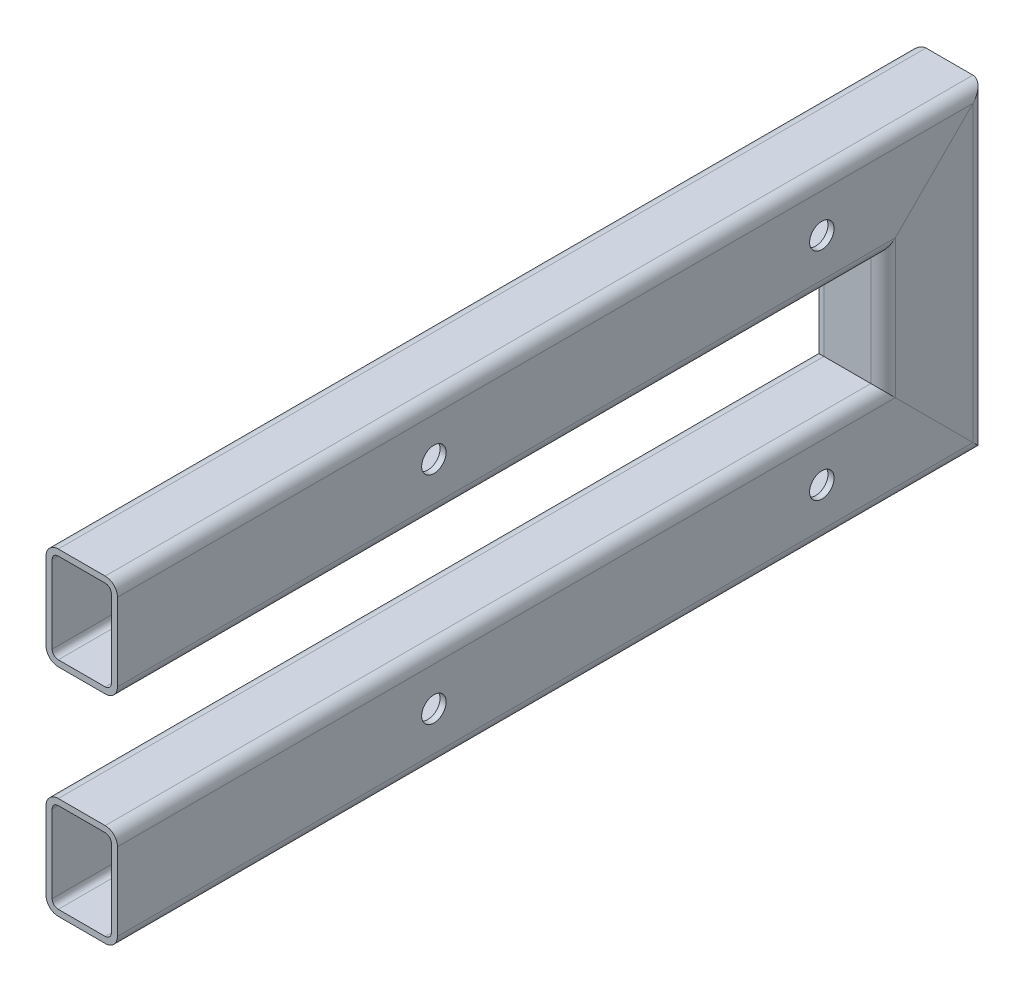
from build123d import *

# Parameters (mm, degrees)
SPLIT1_SURFACE_1_1_BACK  = 455.022
SPLIT1_SURFACE_1_1_DEPTH = 910.044
SPLIT1_SURFACE_1_2_BACK  = 455.022
SPLIT1_SURFACE_1_2_DEPTH = 910.044
SPLIT1_SURFACE_2_3_BACK  = 455.022
SPLIT1_SURFACE_2_3_DEPTH = 910.044
SPLIT1_SURFACE_2_4_BACK  = 455.022
SPLIT1_SURFACE_2_4_DEPTH = 910.044
SKETCH5_R                = 6
CUT_EXTRUDE1_DEPTH       = 434.499165397


with BuildPart() as part:
    # Sweep-Thin1: sweep along a path in Sketch2
    with BuildLine(Plane(origin=(0, 0, 0), x_dir=(0, 0, -1), z_dir=(1, 0, 0))) as sweep_thin1_path:
        Line((0, 52.92), (400, 52.92))
        Line((400, 52.92), (400, -52.92))
        Line((400, -52.92), (0, -52.92))
    # Sketch1 → Sweep-Thin1 (sweep)
    with BuildSketch(Plane.XY):
        with BuildLine():
            Line((6, 77.92), (29, 77.92))
            ThreePointArc((29, 77.92), (33.242640687, 76.162640687), (35, 71.92))
            Line((35, 71.92), (35, 33.92))
            ThreePointArc((35, 33.92), (33.242640687, 29.677359313), (29, 27.92))
            Line((29, 27.92), (6, 27.92))
            ThreePointArc((6, 27.92), (1.757359313, 29.677359313), (0, 33.92))
            Line((0, 33.92), (0, 71.92))
            ThreePointArc((0, 71.92), (1.757359313, 76.162640687), (6, 77.92))
        make_face()
        with BuildLine():
            Line((6, 74.92), (29, 74.92))
            ThreePointArc((29, 74.92), (31.121320344, 74.041320344), (32, 71.92))
            Line((32, 71.92), (32, 33.92))
            ThreePointArc((32, 33.92), (31.121320344, 31.798679656), (29, 30.92))
            Line((29, 30.92), (6, 30.92))
            ThreePointArc((6, 30.92), (3.878679656, 31.798679656), (3, 33.92))
            Line((3, 33.92), (3, 71.92))
            ThreePointArc((3, 71.92), (3.878679656, 74.041320344), (6, 74.92))
        make_face(mode=Mode.SUBTRACT)
    sweep(path=sweep_thin1_path.line, transition=Transition.RIGHT)


with BuildPart() as body_2:
    # Split1: the piece behind the surface
    add(part.part)
    # Split1 surface 1: a surface, the sketch's curves swept straight by 910.044 mm
    with BuildLine(Plane(origin=(0, 0, 0), x_dir=(0, 0, -1), z_dir=(1, 0, 0)).offset(-SPLIT1_SURFACE_1_1_BACK), mode=Mode.PRIVATE) as split1_surface_1_1_path:
        Line((425, 77.92), (375, 27.92))
    split1_surface_1_1 = Shell.extrude(split1_surface_1_1_path.wire(), (1 * SPLIT1_SURFACE_1_1_DEPTH, 0 * SPLIT1_SURFACE_1_1_DEPTH, 0 * SPLIT1_SURFACE_1_1_DEPTH))
    split(bisect_by=split1_surface_1_1, keep=Keep.BOTTOM)


with BuildPart() as part_1:
    add(part.part)

    # Split1: split by a surface, the side it looks to stays
    # Split1 surface 1: a surface, the sketch's curves swept straight by 910.044 mm
    with BuildLine(Plane(origin=(0, 0, 0), x_dir=(0, 0, -1), z_dir=(1, 0, 0)).offset(-SPLIT1_SURFACE_1_2_BACK), mode=Mode.PRIVATE) as split1_surface_1_2_path:
        Line((425, 77.92), (375, 27.92))
    split1_surface_1_2 = Shell.extrude(split1_surface_1_2_path.wire(), (1 * SPLIT1_SURFACE_1_2_DEPTH, 0 * SPLIT1_SURFACE_1_2_DEPTH, 0 * SPLIT1_SURFACE_1_2_DEPTH))
    split(bisect_by=split1_surface_1_2, keep=Keep.TOP)


with BuildPart() as body_3:
    # Split1 2: the piece behind the surface
    add(part_1.part)
    # Split1 surface 2: a surface, the sketch's curves swept straight by 910.044 mm
    with BuildLine(Plane(origin=(0, 0, 0), x_dir=(0, 0, -1), z_dir=(1, 0, 0)).offset(-SPLIT1_SURFACE_2_3_BACK), mode=Mode.PRIVATE) as split1_surface_2_3_path:
        Line((425, -77.92), (375, -27.92))
    split1_surface_2_3 = Shell.extrude(split1_surface_2_3_path.wire(), (1 * SPLIT1_SURFACE_2_3_DEPTH, 0 * SPLIT1_SURFACE_2_3_DEPTH, 0 * SPLIT1_SURFACE_2_3_DEPTH))
    split(bisect_by=split1_surface_2_3, keep=Keep.BOTTOM)


with BuildPart() as part_2:
    add(part_1.part)

    # Split1 2: split by a surface, the side it looks to stays
    # Split1 surface 2: a surface, the sketch's curves swept straight by 910.044 mm
    with BuildLine(Plane(origin=(0, 0, 0), x_dir=(0, 0, -1), z_dir=(1, 0, 0)).offset(-SPLIT1_SURFACE_2_4_BACK), mode=Mode.PRIVATE) as split1_surface_2_4_path:
        Line((425, -77.92), (375, -27.92))
    split1_surface_2_4 = Shell.extrude(split1_surface_2_4_path.wire(), (1 * SPLIT1_SURFACE_2_4_DEPTH, 0 * SPLIT1_SURFACE_2_4_DEPTH, 0 * SPLIT1_SURFACE_2_4_DEPTH))
    split(bisect_by=split1_surface_2_4, keep=Keep.TOP)


with BuildPart() as cut_extrude1_tool:
    # Sketch5 → Cut-Extrude1 (new, through all)
    with BuildSketch(Plane(origin=(0, 0, 0), x_dir=(0, 0, -1), z_dir=(1, 0, 0))):
        with Locations(Location((155, 52.92, 0), (0, 0, 90))):
            Circle(SKETCH5_R)
        with Locations(Location((155, -52.92, 0), (0, 0, 180))):
            Circle(SKETCH5_R)
        with Locations(Location((345, -52.92, 0), (0, 0, 270))):
            Circle(SKETCH5_R)
        with Locations(Location((345, 52.92, 0), (0, 0, 180))):
            Circle(SKETCH5_R)
    extrude(amount=CUT_EXTRUDE1_DEPTH)


with BuildPart() as part_3:
    add(part_2.part)

    # Cut-Extrude1: cut by cut_extrude1_tool
    add(cut_extrude1_tool.part, mode=Mode.SUBTRACT)


with BuildPart() as body_2_1:
    add(body_2.part)

    # Cut-Extrude1: cut by cut_extrude1_tool
    add(cut_extrude1_tool.part, mode=Mode.SUBTRACT)


solid = Compound([body_3.part, part_3.part, body_2_1.part])
